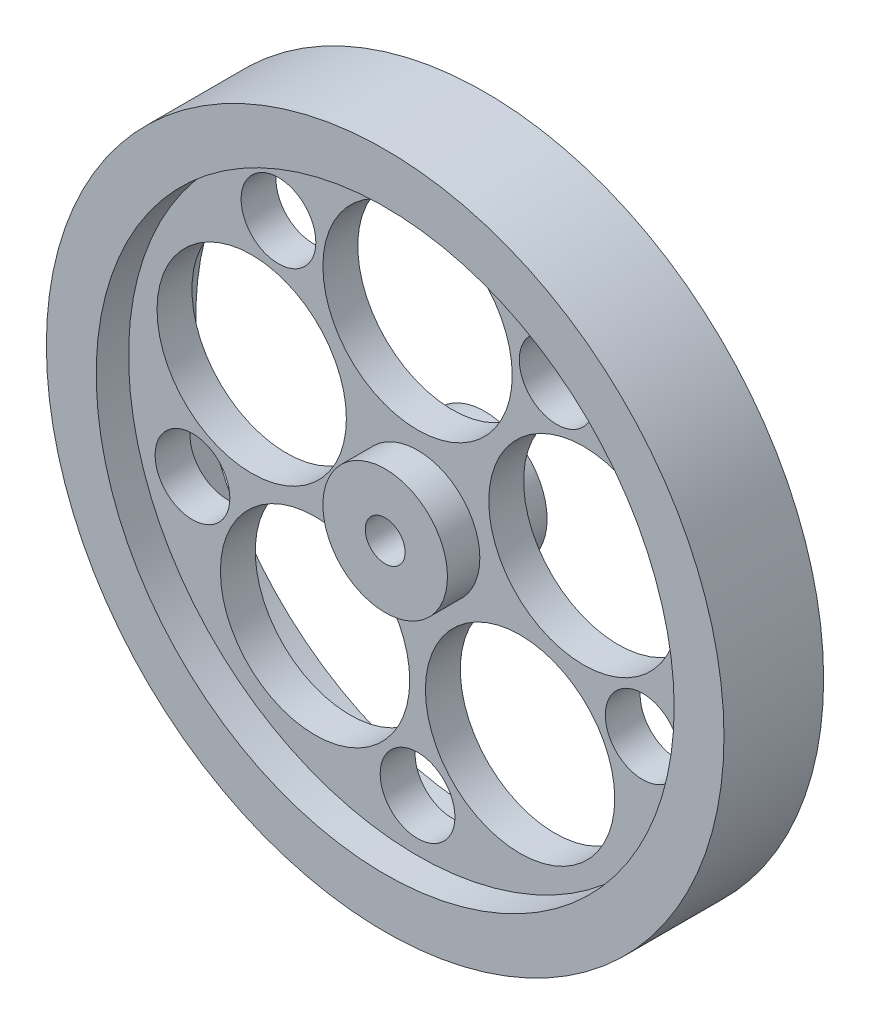
from build123d import *

# Parameters (mm, degrees)
CUT_EXTRUDE1_DEPTH      = 97.685055722
CUT_EXTRUDE1_DEPTH_BACK = 97.685055722
SKETCH2_R               = 7.5
SKETCH2_R_2             = 19


with BuildPart() as part:
    # Sketch1 → Revolve1 (revolve)
    with BuildSketch(Plane(origin=(0, 0, 0), x_dir=(0, 0, -1), z_dir=(1, 0, 0)), mode=Mode.PRIVATE) as revolve1_sk:
        Polygon((-10, 68), (10, 68), (10, 58), (3.5, 58), (3.5, 12.5), (10, 12.5), (10, 4), (-10, 4), (-10, 12.5), (-3.5, 12.5), (-3.5, 58), (-10, 58), align=None)
    revolve(revolve1_sk.sketch.rotate(Axis((0, 0, 51.457627119), (0, 0, -1)), 90), axis=Axis((0, 0, 51.457627119), (0, 0, -1)))

    # Sketch2 → Cut-Extrude1 (cut, two sides: drawn at the far end of the back side and taken through both)
    with BuildSketch(Plane.XY.offset(-CUT_EXTRUDE1_DEPTH_BACK)):
        with Locations((0, -47.5)):
            Circle(SKETCH2_R)
        with Locations((45.175184524, -14.678307233)):
            Circle(SKETCH2_R)
        with Locations((27.919799484, 38.428307233)):
            Circle(SKETCH2_R)
        with Locations((-27.919799484, 38.428307233)):
            Circle(SKETCH2_R)
        with Locations((-45.175184524, -14.678307233)):
            Circle(SKETCH2_R)
        with Locations((0, 35)):
            Circle(SKETCH2_R_2)
        with Locations((33.287669053, 10.81654586)):
            Circle(SKETCH2_R_2)
        with Locations((20.574292847, -28.315007018)):
            Circle(SKETCH2_R_2)
        with Locations((-20.570674813, -28.316182588)):
            Circle(SKETCH2_R_2)
        with Locations((-33.286287087, 10.814643747)):
            Circle(SKETCH2_R_2)
    extrude(amount=CUT_EXTRUDE1_DEPTH + CUT_EXTRUDE1_DEPTH_BACK, mode=Mode.SUBTRACT)


solid = part.part
